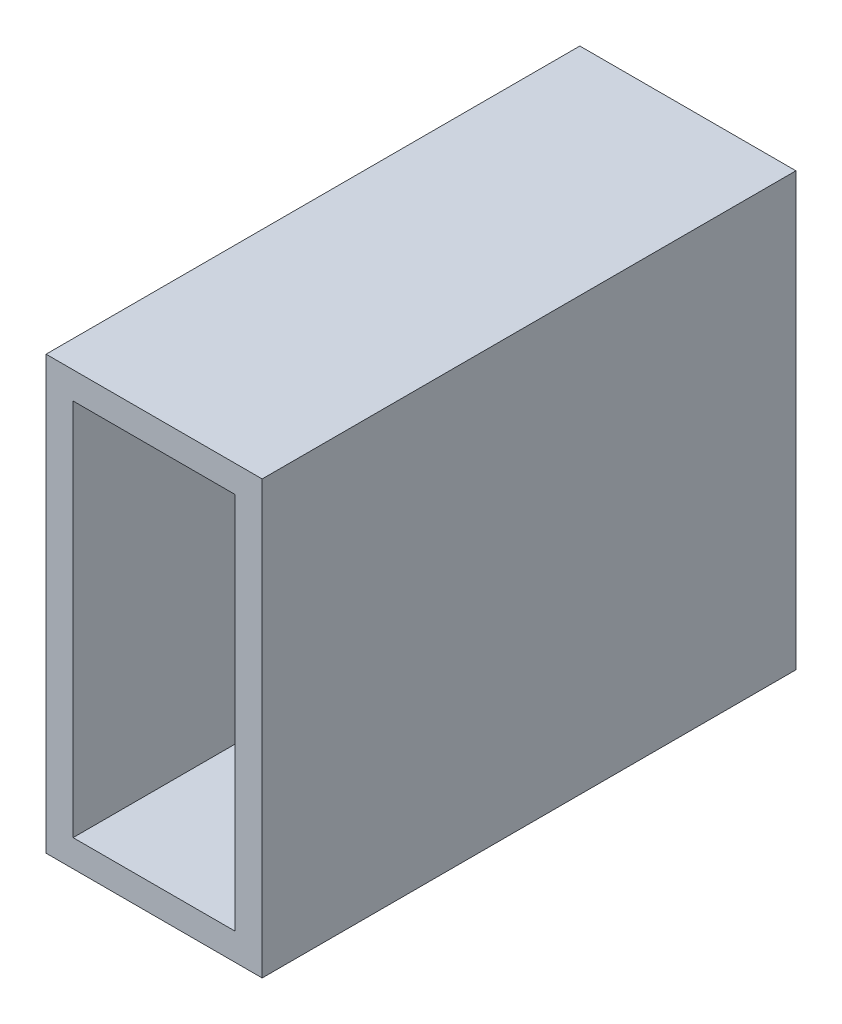
from build123d import *

# Parameters (mm, degrees)
SKETCH1_W           = 25.4
SKETCH1_H           = 50.8
SKETCH1_W_2         = 19.05
SKETCH1_H_2         = 44.45
BOSS_EXTRUDE1_DEPTH = 31.369


with BuildPart() as part:
    # Sketch1 → Boss-Extrude1 (new, symmetric)
    with BuildSketch(Plane.XY):
        Rectangle(SKETCH1_W, SKETCH1_H)
        Rectangle(SKETCH1_W_2, SKETCH1_H_2, mode=Mode.SUBTRACT)
    extrude(amount=BOSS_EXTRUDE1_DEPTH, both=True)


solid = part.part
